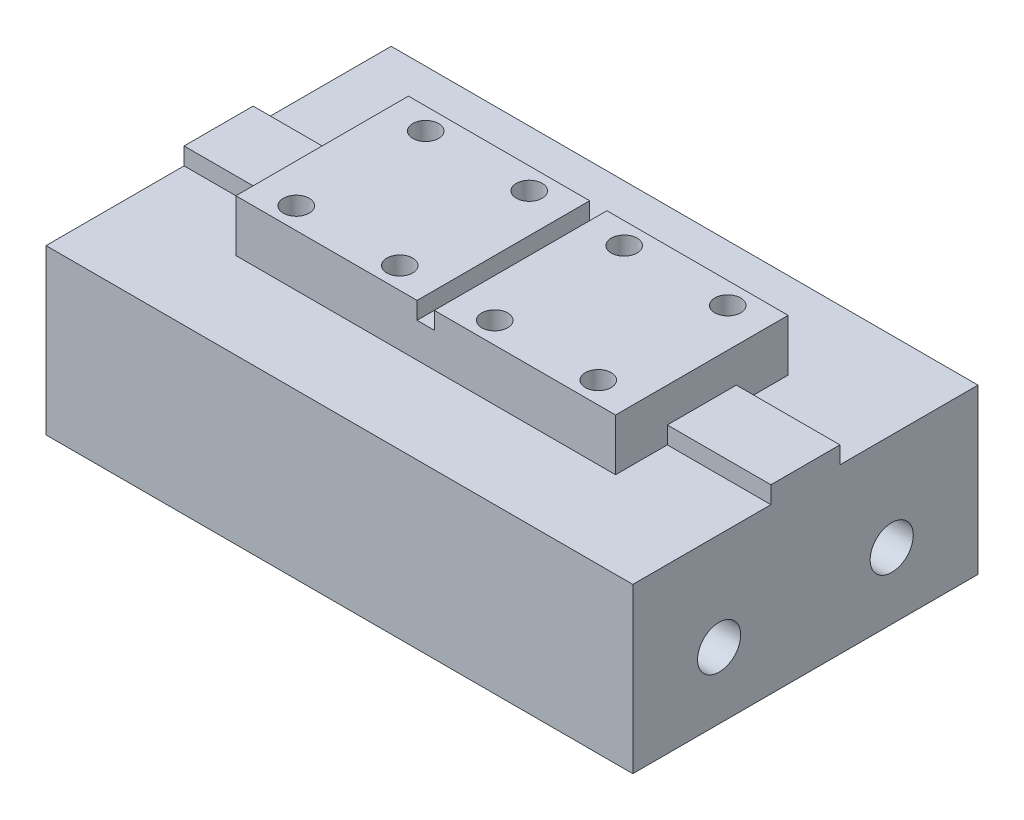
from build123d import *

# Parameters (mm, degrees)
SKETCH_1_W          = 68
SKETCH_1_H          = 40
EXTRUDE_1_DEPTH     = 19
SKETCH_2_W          = 44
SKETCH_2_H          = 20
EXTRUDE_2_DEPTH     = 6
SKETCH_4_W          = 2
SKETCH_4_H          = 20
CUT_EXTRUDE_1_DEPTH = 2
SKETCH_5_W          = 68
SKETCH_5_H          = 8
EXTRUDE_3_DEPTH     = 2
MM_1_AT_2_COUNT     = 2
MM_1_AT_2_PITCH     = 15
MM_1_AT_3_COUNT     = 2
MM_1_AT_3_PITCH     = 19.209372712
MM_1_AT_4_COUNT     = 2
MM_1_AT_4_PITCH     = 12
MM_2_D              = 4
MM_2_DEPTH          = 10
MM_2_TIP            = 1.201721238
MM_3_D              = 5
MM_3_DEPTH          = 5
MM_3_TIP            = 1.502151548


with BuildPart() as part:
    # 草图1 → 凸台-拉伸1 (new body)
    with BuildSketch(Plane(origin=(0, 0, 0), x_dir=(1, 0, 0), z_dir=(0, 1, 0))):
        Rectangle(SKETCH_1_W, SKETCH_1_H)
    extrude(amount=EXTRUDE_1_DEPTH)

    # 草图2 → 凸台-拉伸2 (add)
    with BuildSketch(Plane(origin=(0, 19, 0), x_dir=(1, 0, 0), z_dir=(0, 1, 0))):
        Rectangle(SKETCH_2_W, SKETCH_2_H)
    extrude(amount=EXTRUDE_2_DEPTH)

    # 草图4 → 切除-拉伸1 (cut)
    with BuildSketch(Plane(origin=(0, 25, 0), x_dir=(1, 0, 0), z_dir=(0, 1, 0))):
        Rectangle(SKETCH_4_W, SKETCH_4_H)
    extrude(amount=-CUT_EXTRUDE_1_DEPTH, mode=Mode.SUBTRACT)

    # 草图5 → 凸台-拉伸3 (add)
    with BuildSketch(Plane(origin=(0, 19, 0), x_dir=(1, 0, 0), z_dir=(0, 1, 0))):
        Rectangle(SKETCH_5_W, SKETCH_5_H)
    extrude(amount=EXTRUDE_3_DEPTH)

    # 草图7 → 大小mm 暗销孔1 (revolve, cut)
    with BuildSketch(Plane(origin=(17.5, 25, -7.5), x_dir=(0, 0, 1), z_dir=(1, 0, 0))):
        Polygon((0, 0), (0, 4.901290929), (1.5, 4), (1.5, 0), align=None)
    mm_1 = revolve(axis=Axis((17.5, 31.35, -7.5), (0, -1, 0)), mode=Mode.SUBTRACT)

    # 大小mm 暗销孔1 at 2: 大小mm 暗销孔1 ×2
    with Locations(*[(0, 0, i * MM_1_AT_2_PITCH) for i in range(1, MM_1_AT_2_COUNT)]):
        add(mm_1, mode=Mode.SUBTRACT)

    # 大小mm 暗销孔1 at 3: 大小mm 暗销孔1 ×2
    with Locations(*[Vector(-0.6246950475544242, 0, 0.7808688094430305) * (i * MM_1_AT_3_PITCH) for i in range(1, MM_1_AT_3_COUNT)]):
        add(mm_1, mode=Mode.SUBTRACT)

    # 大小mm 暗销孔1 at 4: 大小mm 暗销孔1 ×2
    with Locations(*[(-i * MM_1_AT_4_PITCH, 0, 0) for i in range(1, MM_1_AT_4_COUNT)]):
        add(mm_1, mode=Mode.SUBTRACT)

    # 镜向1: 大小mm 暗销孔1 across plane
    add(mm_1.mirror(Plane(origin=(0, 0, 0), x_dir=(0, 0, 1), z_dir=(1, 0, 0))), mode=Mode.SUBTRACT)

    # 镜向1 copy 1 sketch → 镜向1 copy 1 (revolve, cut)
    with BuildSketch(Plane(origin=(-17.5, 25, 7.5), x_dir=(0, 0, 1), z_dir=(-1, 0, 0))):
        Polygon((0, 0), (0, -4.901290929), (1.5, -4), (1.5, 0), align=None)
    revolve(axis=Axis((-17.5, 31.35, 7.5), (0, 1, 0)), mode=Mode.SUBTRACT)

    # 镜向1 copy 2 sketch → 镜向1 copy 2 (revolve, cut)
    with BuildSketch(Plane(origin=(-5.5, 25, 7.5), x_dir=(0, 0, 1), z_dir=(-1, 0, 0))):
        Polygon((0, 0), (0, -4.901290929), (1.5, -4), (1.5, 0), align=None)
    revolve(axis=Axis((-5.5, 31.35, 7.5), (0, 1, 0)), mode=Mode.SUBTRACT)

    # 镜向1 copy 3 sketch → 镜向1 copy 3 (revolve, cut)
    with BuildSketch(Plane(origin=(-5.5, 25, -7.5), x_dir=(0, 0, 1), z_dir=(-1, 0, 0))):
        Polygon((0, 0), (0, -4.901290929), (1.5, -4), (1.5, 0), align=None)
    revolve(axis=Axis((-5.5, 31.35, -7.5), (0, 1, 0)), mode=Mode.SUBTRACT)

    # 大小mm 暗销孔2
    with Locations(Plane(origin=(21, 0, 0), x_dir=(0, 0, -1), z_dir=(0, -1, 0))):
        with Locations((0, 0), (0, -42)):
            Hole(MM_2_D / 2, depth=MM_2_DEPTH)
            with Locations((0, 0, -(MM_2_DEPTH + MM_2_TIP / 2))):  # 118° drill point
                Cone(0, MM_2_D / 2, MM_2_TIP, mode=Mode.SUBTRACT)

    # 大小mm 暗销孔3
    with Locations(Plane(origin=(34, 7.7, -10), x_dir=(0, 0, 1), z_dir=(1, 0, 0))):
        with Locations((0, 0), (20, 0)):
            Hole(MM_3_D / 2, depth=MM_3_DEPTH)
            with Locations((0, 0, -(MM_3_DEPTH + MM_3_TIP / 2))):  # 118° drill point
                Cone(0, MM_3_D / 2, MM_3_TIP, mode=Mode.SUBTRACT)


solid = part.part
